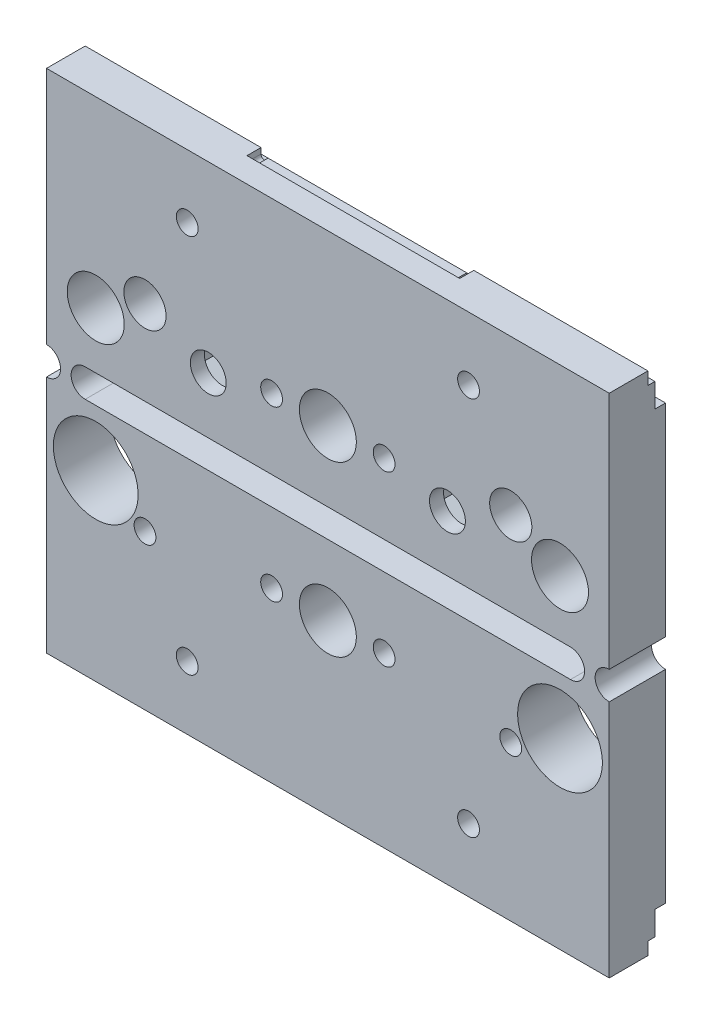
from build123d import *

# Parameters (mm, degrees)
SKETCH_2_W           = 80
SKETCH_2_H           = 34
SKETCH_2_R           = 4.05
EXTRUDE_1_DEPTH      = 8
SKETCH_3_R           = 2.55
CUT_EXTRUDE_1_DEPTH  = 88.292611371
CUT_EXTRUDE_2_DEPTH  = 88.292611371
SKETCH_5_R           = 1.55
CUT_EXTRUDE_3_DEPTH  = 88.292611371
CUT_EXTRUDE_5_DEPTH  = 4.5
SKETCH_25_R          = 1.55
CUT_EXTRUDE_13_DEPTH = 88.292611371
CUT_EXTRUDE_11_DEPTH = 2
EXTRUDE_2_DEPTH      = 8
SKETCH_26_R          = 6.025
CUT_EXTRUDE_14_DEPTH = 89.926936302
SKETCH_27_R          = 3
SKETCH_27_R_2        = 1.55
CUT_EXTRUDE_15_DEPTH = 89.926936302
CUT_EXTRUDE_16_DEPTH = 6


with BuildPart() as part:
    # 草图2 → 凸台-拉伸1 (new body)
    with BuildSketch(Plane.XY):
        with Locations((40, 17)):
            Rectangle(SKETCH_2_W, SKETCH_2_H)
        with Locations((7, 8)):
            Circle(SKETCH_2_R, mode=Mode.SUBTRACT)
        with Locations((40, 10)):
            Circle(SKETCH_2_R, mode=Mode.SUBTRACT)
        with Locations((73, 8)):
            Circle(SKETCH_2_R, mode=Mode.SUBTRACT)
    extrude_1 = extrude(amount=EXTRUDE_1_DEPTH)

    # 草图3 → 切除-拉伸1 (cut, through all)
    with BuildSketch(Plane.XY.offset(8)):
        with Locations((23, 8)):
            Circle(SKETCH_3_R)
        with Locations((57, 8)):
            Circle(SKETCH_3_R)
    extrude(amount=-CUT_EXTRUDE_1_DEPTH, mode=Mode.SUBTRACT)

    # 草图4 → 切除-拉伸2 (cut, through all)
    with BuildSketch(Plane(origin=(80, 0, 0), x_dir=(0, 0, -1), z_dir=(1, 0, 0))):
        Polygon((-1.5, 32.2), (-2.5, 32.2), (-2.5, 34), (0, 34), (0, 28.8), (-1.5, 28.8), align=None)
    cut_extrude_2 = extrude(amount=-CUT_EXTRUDE_2_DEPTH, mode=Mode.SUBTRACT)

    # 草图5 → 切除-拉伸3 (cut, through all)
    with BuildSketch(Plane.XY.offset(8)):
        with Locations((48, 10)):
            Circle(SKETCH_5_R)
        with Locations((32, 10)):
            Circle(SKETCH_5_R)
    cut_extrude_3 = extrude(amount=-CUT_EXTRUDE_3_DEPTH, mode=Mode.SUBTRACT)

    # 草图8 → 切除-拉伸5 (cut)
    with BuildSketch(Plane(origin=(0, 0, 0), x_dir=(-1, 0, 0), z_dir=(0, 0, -1))):
        Polygon((-45.15, 8.354551733), (-45.15, 11.645448267), (-48, 13.290896534), (-50.85, 11.645448267), (-50.85, 8.354551733), (-48, 6.709103466), align=None)
        Polygon((-29.15, 8.354551733), (-29.15, 11.645448267), (-32, 13.290896534), (-34.85, 11.645448267), (-34.85, 8.354551733), (-32, 6.709103466), align=None)
    cut_extrude_5 = extrude(amount=-CUT_EXTRUDE_5_DEPTH, mode=Mode.SUBTRACT)

    # 草图25 → 切除-拉伸13 (cut, through all)
    with BuildSketch(Plane(origin=(0, 0, 0), x_dir=(-1, 0, 0), z_dir=(0, 0, -1))):
        with Locations((-60, 25)):
            Circle(SKETCH_25_R)
        with Locations((-20, 25)):
            Circle(SKETCH_25_R)
    cut_extrude_13 = extrude(amount=-CUT_EXTRUDE_13_DEPTH, mode=Mode.SUBTRACT)

    # 草图19 → 切除-拉伸11 (cut)
    with BuildSketch(Plane(origin=(0, 0, 2.5), x_dir=(-1, 0, 0), z_dir=(0, 0, -1))):
        with BuildLine():
            Line((-25, 34), (-55.247938178, 34))
            Line((-55.247938178, 34), (-55.247938178, 33.2))
            ThreePointArc((-55.247938178, 33.2), (-54.747938178, 32.7), (-54.247938178, 33.2))
            Line((-54.247938178, 33.2), (-26, 33.2))
            ThreePointArc((-26, 33.2), (-25.5, 32.7), (-25, 33.2))
            Line((-25, 33.2), (-25, 34))
        make_face()
    cut_extrude_11 = extrude(amount=-CUT_EXTRUDE_11_DEPTH, mode=Mode.SUBTRACT)

    # 草图22 → 凸台-拉伸2 (add)
    with BuildSketch(Plane.XY.offset(8)):
        with BuildLine():
            Line((0, -4), (5.5, -4))
            ThreePointArc((5.5, -4), (3.5, -2), (5.5, 0))
            Line((5.5, 0), (0, 0))
            ThreePointArc((0, 0), (2, -2), (0, -4))
        make_face()
        with BuildLine():
            Line((80, 0), (74.5, 0))
            ThreePointArc((74.5, 0), (76.5, -2), (74.5, -4))
            Line((74.5, -4), (80, -4))
            ThreePointArc((80, -4), (78, -2), (80, 0))
        make_face()
    extrude(amount=-EXTRUDE_2_DEPTH)

    # 镜向2: 凸台-拉伸1, 切除-拉伸2, 切除-拉伸3, 切除-拉伸5, 切除-拉伸13, 切除-拉伸11 across plane
    add(extrude_1.mirror(Plane(origin=(0, -2, 0), x_dir=(0, 0, 1), z_dir=(0, -1, 0))))
    add(cut_extrude_2.mirror(Plane(origin=(0, -2, 0), x_dir=(0, 0, 1), z_dir=(0, -1, 0))), mode=Mode.SUBTRACT)
    add(cut_extrude_3.mirror(Plane(origin=(0, -2, 0), x_dir=(0, 0, 1), z_dir=(0, -1, 0))), mode=Mode.SUBTRACT)
    add(cut_extrude_5.mirror(Plane(origin=(0, -2, 0), x_dir=(0, 0, 1), z_dir=(0, -1, 0))), mode=Mode.SUBTRACT)
    add(cut_extrude_13.mirror(Plane(origin=(0, -2, 0), x_dir=(0, 0, 1), z_dir=(0, -1, 0))), mode=Mode.SUBTRACT)
    add(cut_extrude_11.mirror(Plane(origin=(0, -2, 0), x_dir=(0, 0, 1), z_dir=(0, -1, 0))), mode=Mode.SUBTRACT)

    # 草图26 → 切除-拉伸14 (cut, through all)
    with BuildSketch(Plane(origin=(0, 0, 0), x_dir=(-1, 0, 0), z_dir=(0, 0, -1))):
        with Locations((-73, -12)):
            Circle(SKETCH_26_R)
        with Locations((-7, -12)):
            Circle(SKETCH_26_R)
    extrude(amount=-CUT_EXTRUDE_14_DEPTH, mode=Mode.SUBTRACT)

    # 草图27 → 切除-拉伸15 (cut, through all)
    with BuildSketch(Plane(origin=(0, 0, 0), x_dir=(-1, 0, 0), z_dir=(0, 0, -1))):
        with Locations((-66, 12)):
            Circle(SKETCH_27_R)
        with Locations((-66, -16)):
            Circle(SKETCH_27_R_2)
        with Locations((-14, -16)):
            Circle(SKETCH_27_R_2)
        with Locations((-14, 12)):
            Circle(SKETCH_27_R)
    extrude(amount=-CUT_EXTRUDE_15_DEPTH, mode=Mode.SUBTRACT)

    # 草图28 → 切除-拉伸16 (cut)
    with BuildSketch(Plane(origin=(0, 0, 0), x_dir=(-1, 0, 0), z_dir=(0, 0, -1))):
        Polygon((-52.9, 5.632863896), (-52.9, 10.367136104), (-57, 12.734272207), (-61.1, 10.367136104), (-61.1, 5.632863896), (-57, 3.265727793), align=None)
        Polygon((-18.9, 5.632863896), (-18.9, 10.367136104), (-23, 12.734272207), (-27.1, 10.367136104), (-27.1, 5.632863896), (-23, 3.265727793), align=None)
    extrude(amount=-CUT_EXTRUDE_16_DEPTH, mode=Mode.SUBTRACT)


solid = part.part
